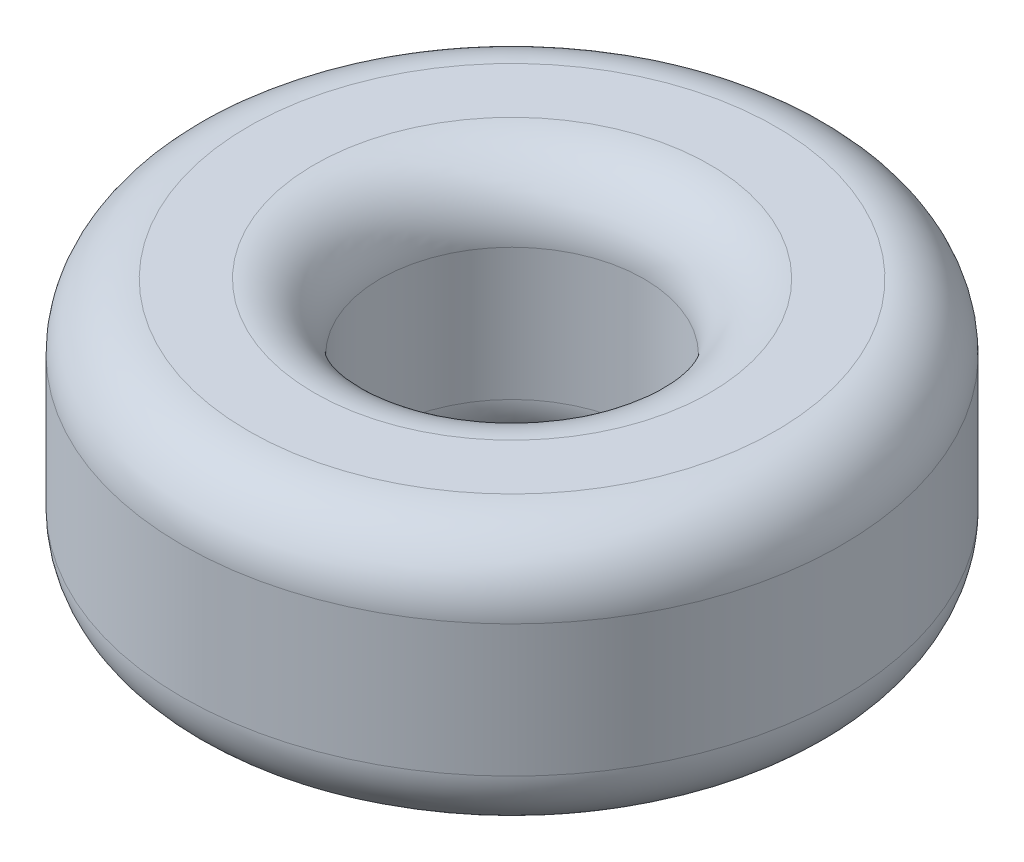
from build123d import *

# Parameters (mm, degrees)
SKETCH1_R           = 50
SKETCH1_R_2         = 20
BOSS_EXTRUDE1_DEPTH = 40
FILLET1_R           = 10


with BuildPart() as part:
    # Sketch1 → Boss-Extrude1 (new body)
    with BuildSketch(Plane(origin=(0, 0, 0), x_dir=(1, 0, 0), z_dir=(0, 1, 0))):
        with Locations(Location((0, 0, 0), (0, 0, 270))):
            Circle(SKETCH1_R)
        with Locations(Location((0, 0, 0), (0, 0, 270))):
            Circle(SKETCH1_R_2, mode=Mode.SUBTRACT)
    extrude(amount=BOSS_EXTRUDE1_DEPTH)

    # Fillet1
    fillet1_edges = [part.edges().sort_by_distance(p)[0] for p in [
        (0, 0, -50),
        (0, 40, -50),
        (0, 0, -20),
        (0, 40, -20),
    ]]
    fillet(fillet1_edges, radius=FILLET1_R)


solid = part.part
